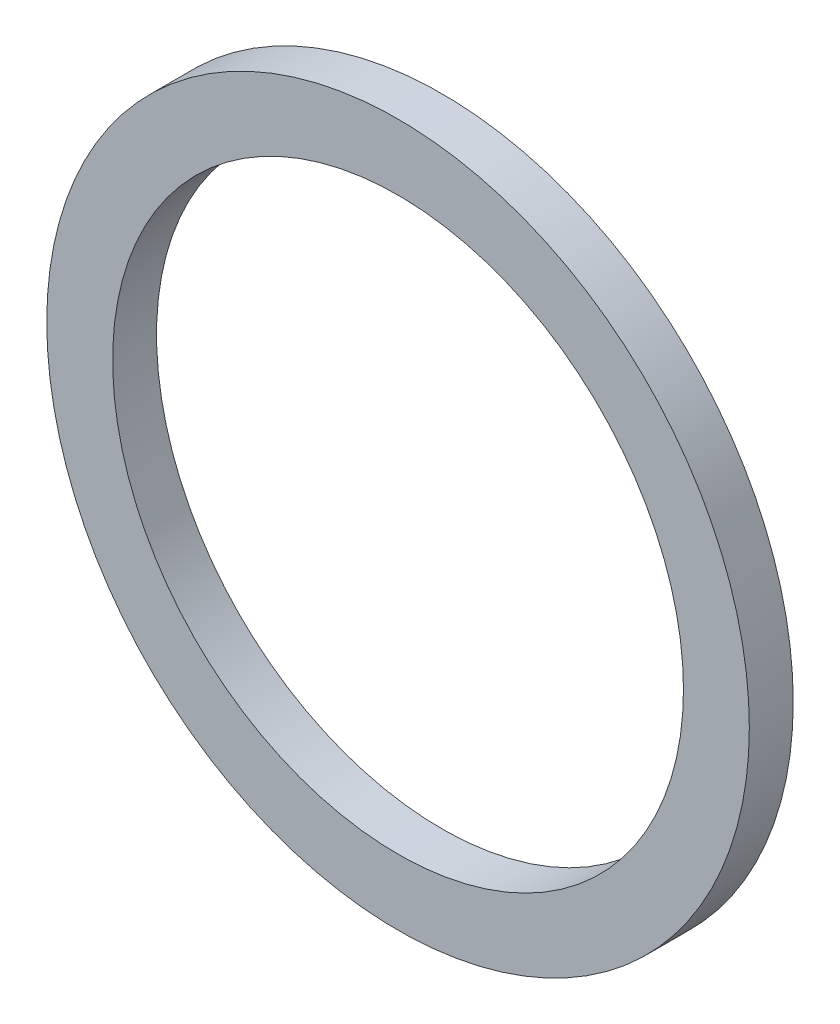
from build123d import *

# Parameters (mm, degrees)
SKETCH1_R           = 101.6
SKETCH1_R_2         = 95.25
SKETCH1_R_3         = 82.55
BOSS_EXTRUDE1_DEPTH = 12.7


with BuildPart() as part:
    # Sketch1 → Boss-Extrude1 (new body)
    # profile 1 of 2: a face of its own
    with BuildSketch(Plane.XY):
        Circle(SKETCH1_R)
        Circle(SKETCH1_R_2, mode=Mode.SUBTRACT)
    # profile 2 of 2: a face of its own
    with BuildSketch(Plane.XY):
        Circle(SKETCH1_R_2)
        Circle(SKETCH1_R_3, mode=Mode.SUBTRACT)
    extrude(amount=BOSS_EXTRUDE1_DEPTH)


solid = part.part
